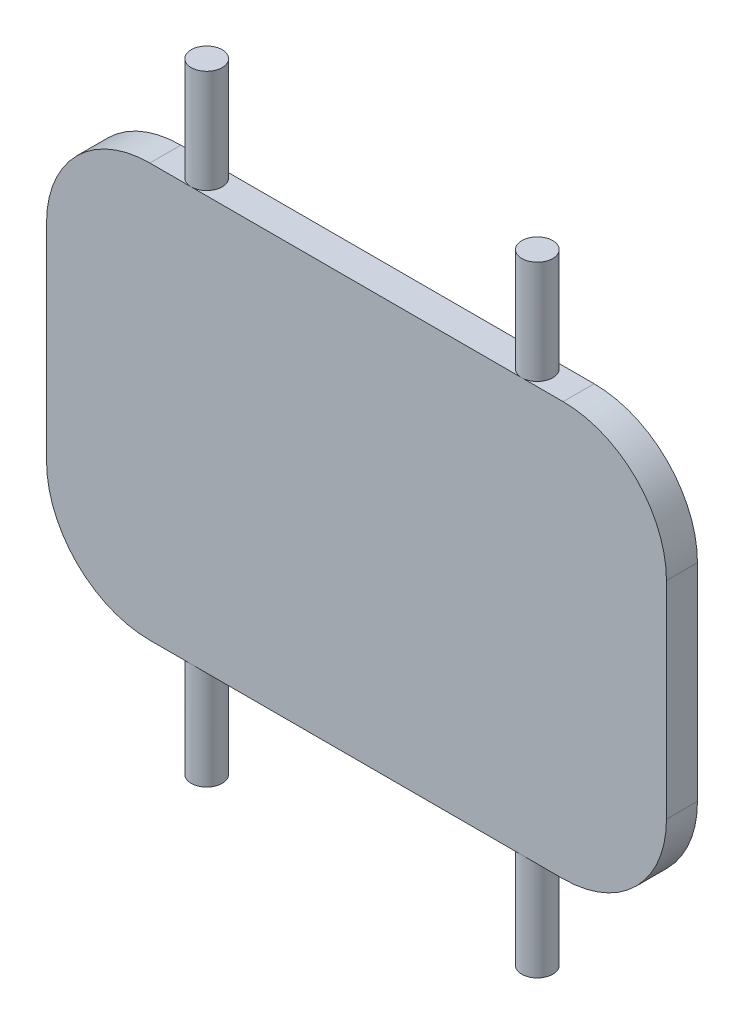
from build123d import *

# Parameters (mm, degrees)
SKETCH3_W               = 300
SKETCH3_H               = 200
BOSS_EXTRUDE1_DEPTH     = 15
FILLET1_R               = 50
SKETCH7_R               = 7.5
BOSS_EXTRUDE2_DEPTH     = 50
MIRROR2_COPY_1_SKETCH_R = 7.5
MIRROR2_COPY_1_DEPTH    = 50


with BuildPart() as part:
    # Sketch3 → Boss-Extrude1 (new body)
    with BuildSketch(Plane.XY):
        Rectangle(SKETCH3_W, SKETCH3_H)
    extrude(amount=BOSS_EXTRUDE1_DEPTH)

    # Fillet1
    fillet1_edges = [part.edges().sort_by_distance(p)[0] for p in [
        (150, -100, 7.5),
        (-150, -100, 7.5),
        (-150, 100, 7.5),
        (150, 100, 7.5),
    ]]
    fillet(fillet1_edges, radius=FILLET1_R)

    # Sketch7 → Boss-Extrude2 (add)
    with BuildSketch(Plane.XZ.offset(100)):
        with Locations(Location((80, 7.5, 0), (0, 0, 270))):
            Circle(SKETCH7_R)
    boss_extrude2 = extrude(amount=BOSS_EXTRUDE2_DEPTH)

    # Mirror1: Boss-Extrude2 across plane
    add(boss_extrude2.mirror(Plane(origin=(0, 0, 0), x_dir=(0, 0, 1), z_dir=(1, 0, 0))))

    # Mirror2: Boss-Extrude2 across plane
    add(boss_extrude2.mirror(Plane.ZX))

    # Mirror2 copy 1 sketch → Mirror2 copy 1 (add)
    with BuildSketch(Plane(origin=(0, 100, 0), x_dir=(-1, 0, 0), z_dir=(0, 1, 0))):
        with Locations(Location((80, 7.5, 0), (0, 0, 270))):
            Circle(MIRROR2_COPY_1_SKETCH_R)
    extrude(amount=MIRROR2_COPY_1_DEPTH)


solid = part.part
